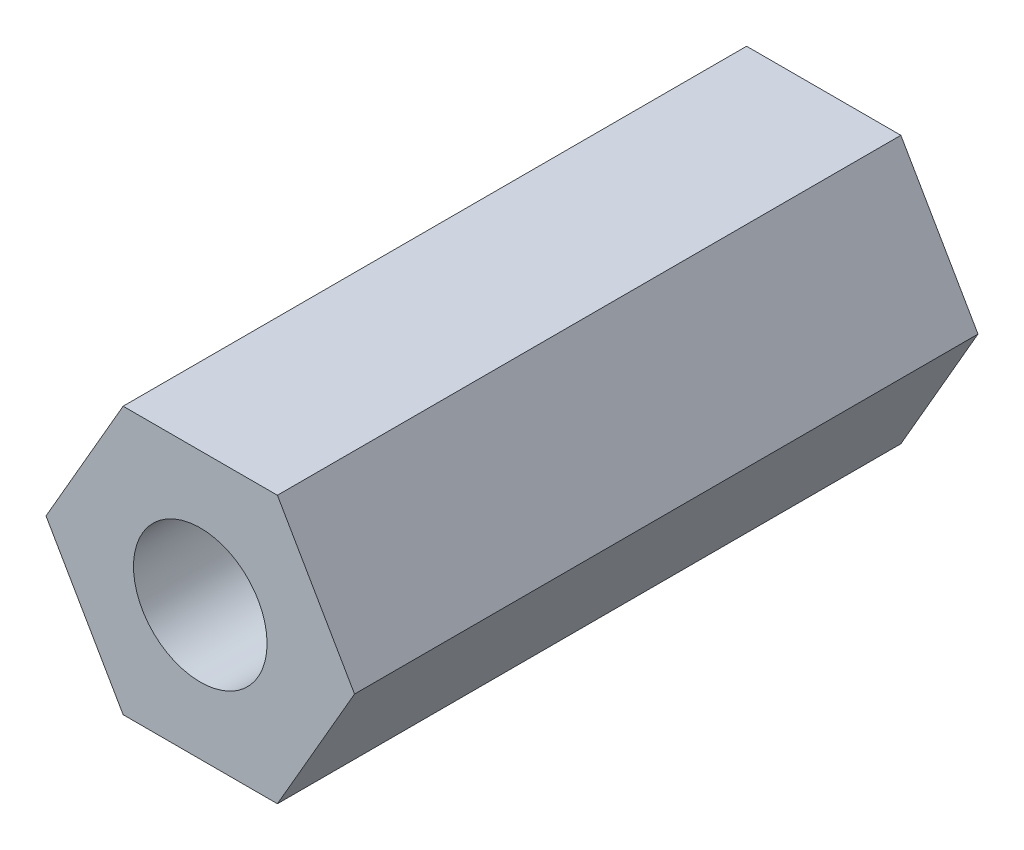
from build123d import *

# Parameters (mm, degrees)
EXTRUDE_1_DEPTH     = 13
SKETCH_2_R          = 1.5
CUT_EXTRUDE_1_DEPTH = 16.231546212
EXTRUDE_2_DEPTH     = 1
SKETCH_2_2_R        = 1.5
CUT_EXTRUDE_2_DEPTH = 15


with BuildPart() as part:
    # 草图1 → 凸台-拉伸1 (new body)
    with BuildSketch(Plane.XY):
        Polygon((0, 0), (3.464101615, 0), (5.196152423, -3), (3.464101615, -6), (0, -6), (-1.732050808, -3), align=None)
    extrude(amount=EXTRUDE_1_DEPTH)

    # 草图2 → 切除-拉伸1 (cut, through all)
    with BuildSketch(Plane.XY.offset(13)):
        with Locations((1.732050808, -3)):
            Circle(SKETCH_2_R)
    extrude(amount=-CUT_EXTRUDE_1_DEPTH, mode=Mode.SUBTRACT)

    # 草图1<2> → 凸台-拉伸2 (add)
    with BuildSketch(Plane.XY):
        Polygon((0, 0), (3.464101615, 0), (5.196152423, -3), (3.464101615, -6), (0, -6), (-1.732050808, -3), align=None)
    extrude(amount=-EXTRUDE_2_DEPTH)

    # 草图2<2> → 切除-拉伸2 (cut)
    with BuildSketch(Plane.XY.offset(13)):
        with Locations((1.732050808, -3)):
            Circle(SKETCH_2_2_R)
    extrude(amount=-CUT_EXTRUDE_2_DEPTH, mode=Mode.SUBTRACT)


solid = part.part
